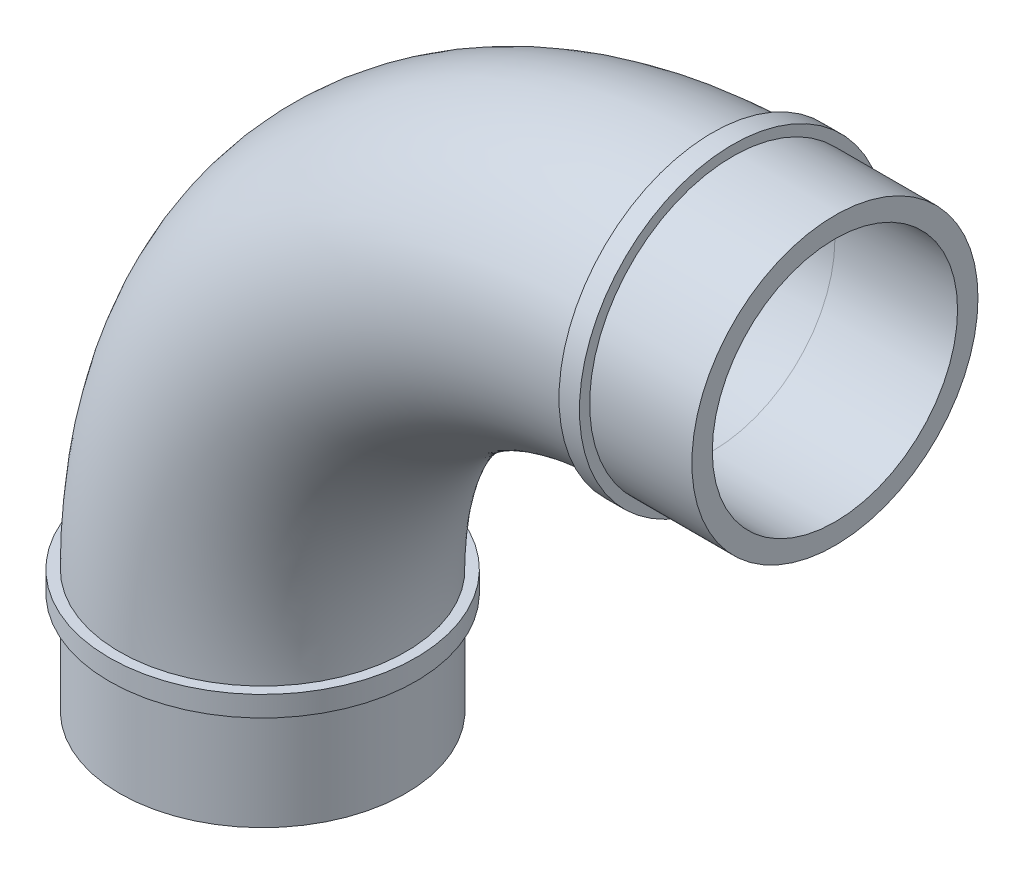
from build123d import *

# Parameters (mm, degrees)
SKETCH1_R           = 7
BOSS_EXTRUDE1_DEPTH = 1
SKETCH2_R           = 7
BOSS_EXTRUDE2_DEPTH = 4
SKETCH3_R           = 7.5
BOSS_EXTRUDE3_DEPTH = 1
SKETCH5_R           = 7
SKETCH7_R           = 7.5
BOSS_EXTRUDE4_DEPTH = 1
SKETCH8_R           = 7
BOSS_EXTRUDE5_DEPTH = 4
SKETCH9_R           = 7
BOSS_EXTRUDE6_DEPTH = 1
SKETCH11_R          = 6


with BuildPart() as part:
    # Sketch1 → Boss-Extrude1 (new body)
    with BuildSketch(Plane(origin=(0, 0, 0), x_dir=(1, 0, 0), z_dir=(0, 1, 0))):
        with Locations(Location((0, 0, 0), (0, 0, 270))):
            Circle(SKETCH1_R)
    extrude(amount=BOSS_EXTRUDE1_DEPTH)

    # Sketch2 → Boss-Extrude2 (add)
    with BuildSketch(Plane(origin=(0, 1, 0), x_dir=(1, 0, 0), z_dir=(0, 1, 0))):
        with Locations(Location((0, 0, 0), (0, 0, 270))):
            Circle(SKETCH2_R)
    extrude(amount=BOSS_EXTRUDE2_DEPTH)

    # Sketch3 → Boss-Extrude3 (add)
    with BuildSketch(Plane(origin=(0, 5, 0), x_dir=(1, 0, 0), z_dir=(0, 1, 0))):
        with Locations(Location((0, 0, 0), (0, 0, 270))):
            Circle(SKETCH3_R)
    extrude(amount=BOSS_EXTRUDE3_DEPTH)

    # Sweep1: sweep along a path in Sketch4
    with BuildLine(Plane.XY) as sweep1_path:
        ThreePointArc((0, 6), (6.443650814, 21.556349186), (22, 28))
    # Sketch5 → Sweep1 (sweep)
    with BuildSketch(Plane(origin=(0, 6, 0), x_dir=(1, 0, 0), z_dir=(0, 1, 0))):
        Circle(SKETCH5_R)
    sweep(path=sweep1_path.line)

    # Sketch7 → Boss-Extrude4 (add)
    with BuildSketch(Plane(origin=(22, 0, 0), x_dir=(0, 0, -1), z_dir=(1, 0, 0))):
        with Locations((0, 28)):
            Circle(SKETCH7_R)
    extrude(amount=BOSS_EXTRUDE4_DEPTH)

    # Sketch8 → Boss-Extrude5 (add)
    with BuildSketch(Plane(origin=(23, 0, 0), x_dir=(0, 0, -1), z_dir=(1, 0, 0))):
        with Locations((0, 28)):
            Circle(SKETCH8_R)
    extrude(amount=BOSS_EXTRUDE5_DEPTH)

    # Sketch9 → Boss-Extrude6 (add)
    with BuildSketch(Plane(origin=(27, 0, 0), x_dir=(0, 0, -1), z_dir=(1, 0, 0))):
        with Locations((0, 28)):
            Circle(SKETCH9_R)
    extrude(amount=BOSS_EXTRUDE6_DEPTH)

    # Cut-Sweep1: sweep along a path in Sketch10
    with BuildLine(Plane.XY) as cut_sweep1_path:
        Line((0, 0), (0, 6))
        ThreePointArc((0, 6), (6.443650814, 21.556349186), (22, 28))
        Line((22, 28), (28, 28))
    # Sketch11 → Cut-Sweep1 (sweep, cut)
    with BuildSketch(Plane.XZ):
        Circle(SKETCH11_R)
    sweep(path=cut_sweep1_path.line, mode=Mode.SUBTRACT)


solid = part.part
